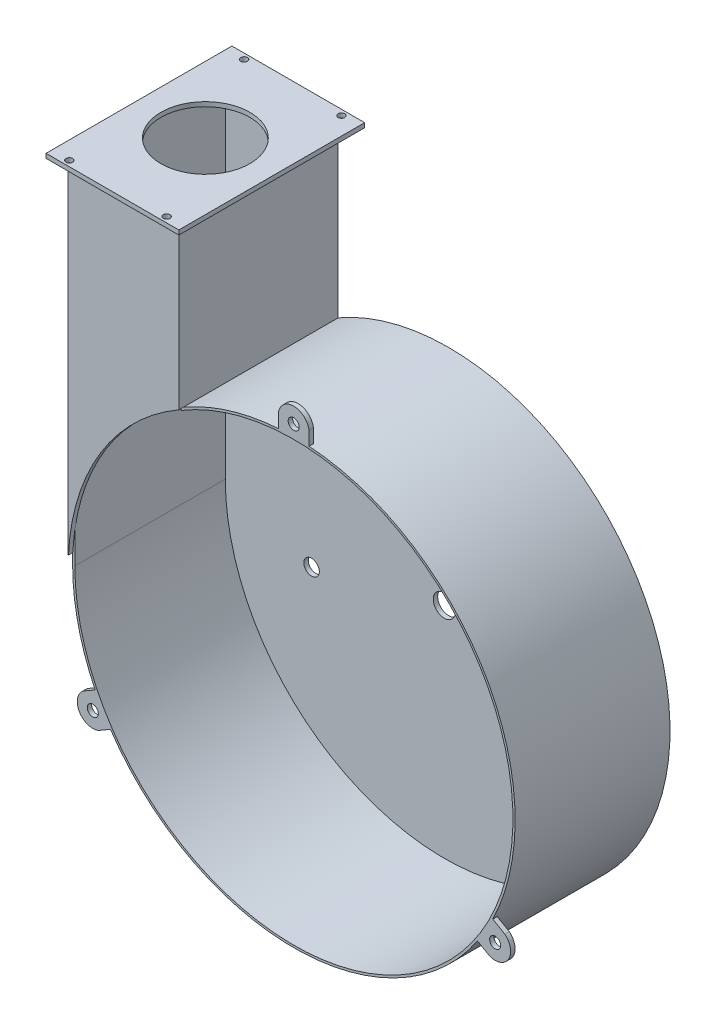
from build123d import *

# Parameters (mm, degrees)
IZIM1_R                     = 3.5
IZIM1_R_2                   = 5
Y_KSEKLIK_EKSTR_ZYON1_DEPTH = 2
Y_KSEKLIK_EKSTR_ZYON3_DEPTH = 68
Y_KSEKLIK_EKSTR_ZYON4_DEPTH = 2
Y_KSEKLIK_EKSTR_ZYON6_START = -2
IZIM6_R                     = 2.5
Y_KSEKLIK_EKSTR_ZYON6_DEPTH = 2
IZIM8_W                     = 60
IZIM8_H                     = 84
IZIM8_R                     = 20.122069198
IZIM8_R_2                   = 1.5
Y_KSEKLIK_EKSTR_ZYON7_DEPTH = 2


with BuildPart() as part:
    # Çizim1 → Yükseklik-Ekstrüzyon1 (new body)
    with BuildSketch(Plane.XY):
        with BuildLine():
            Line((-100, 0), (-100, 160))
            Line((-100, 160), (-50, 160))
            Line((-50, 160), (-50, 86.602540378))
            ThreePointArc((-50, 86.602540378), (86.602540378, -50), (-100, 0))
        make_face()
        with Locations((-60, -15)):
            Circle(IZIM1_R, mode=Mode.SUBTRACT)
        with Locations((60, -15)):
            Circle(IZIM1_R, mode=Mode.SUBTRACT)
        Circle(IZIM1_R_2, mode=Mode.SUBTRACT)
    extrude(amount=Y_KSEKLIK_EKSTR_ZYON1_DEPTH)

    # Çizim2 → Yükseklik-Ekstrüzyon3 (add)
    with BuildSketch(Plane.XY.offset(2)):
        with BuildLine():
            Line((-50, 86.602540378), (-50, 160))
            Line((-50, 160), (-51, 160))
            Line((-51, 160), (-51, 159))
            Line((-51, 159), (-51, 84.852813742))
            ThreePointArc((-51, 84.852813742), (86.168439698, -48.744230428), (-99, 0))
            Line((-99, 0), (-99, 159))
            Line((-99, 159), (-99, 160))
            Line((-99, 160), (-100, 160))
            Line((-100, 160), (-100, 0))
            ThreePointArc((-100, 0), (86.602540378, -50), (-50, 86.602540378))
        make_face()
    extrude(amount=Y_KSEKLIK_EKSTR_ZYON3_DEPTH)

    # Çizim4 → Yükseklik-Ekstrüzyon4 (add)
    with BuildSketch(Plane.XY.offset(70)):
        with BuildLine():
            Line((-100, 160), (-50, 160))
            Line((-50, 160), (-50, 86.602540378))
            ThreePointArc((-50, 86.602540378), (-85.384878706, 52.052113198), (-99.88613884, 4.77066743))
            Line((-99.88613884, 4.77066743), (-100, 4.77066743))
            Line((-100, 4.77066743), (-100, 160))
        make_face()
    extrude(amount=Y_KSEKLIK_EKSTR_ZYON4_DEPTH)

    # Çizim6 → Yükseklik-Ekstrüzyon6 (add)
    # profile 1 of 3: a face of its own
    with BuildSketch(Plane.XY.offset(70).offset(Y_KSEKLIK_EKSTR_ZYON6_START)):
        with BuildLine():
            ThreePointArc((-7, 99.754699137), (-0.077865091, 99.999969685), (6.844643384, 99.765479285))
            Line((6.844643384, 99.765479285), (6.844643384, 106.039933839))
            ThreePointArc((6.844643384, 106.039933839), (-0.077678308, 112), (-7, 106.039933839))
            Line((-7, 106.039933839), (-7, 99.754699137))
        make_face()
        with Locations((-0.077678308, 105)):
            Circle(IZIM6_R, mode=Mode.SUBTRACT)
    # profile 2 of 3: a face of its own
    with BuildSketch(Plane.XY.offset(70).offset(Y_KSEKLIK_EKSTR_ZYON6_START)):
        with BuildLine():
            Line((-88.33327652, -59.082144746), (-82.8901036, -55.939527395))
            ThreePointArc((-82.8901036, -55.939527395), (-86.563581579, -50.067417989), (-89.821761174, -43.955104592))
            Line((-89.821761174, -43.955104592), (-95.255598212, -47.092331869))
            ThreePointArc((-95.255598212, -47.092331869), (-96.95600607, -56.067271388), (-88.33327652, -59.082144746))
        make_face()
        with Locations((-90.893828243, -52.567271388)):
            Circle(IZIM6_R, mode=Mode.SUBTRACT)
    # profile 3 of 3: a face of its own
    with BuildSketch(Plane.XY.offset(70).offset(Y_KSEKLIK_EKSTR_ZYON6_START)):
        with BuildLine():
            ThreePointArc((88.410954828, -58.94760197), (97.033684378, -55.932728612), (95.33327652, -46.957789093))
            Line((95.33327652, -46.957789093), (89.8901036, -43.815171742))
            ThreePointArc((89.8901036, -43.815171742), (86.641446671, -49.932551696), (82.977117789, -55.810374693))
            Line((82.977117789, -55.810374693), (88.410954828, -58.94760197))
        make_face()
        with Locations((90.971506551, -52.432728612)):
            Circle(IZIM6_R, mode=Mode.SUBTRACT)
    extrude(amount=Y_KSEKLIK_EKSTR_ZYON6_DEPTH)

    # Çizim8 → Yükseklik-Ekstrüzyon7 (add)
    with BuildSketch(Plane(origin=(0, 160, 0), x_dir=(1, 0, 0), z_dir=(0, 1, 0))):
        with Locations((-75, -35)):
            Rectangle(IZIM8_W, IZIM8_H)
        with Locations(Location((-75, -35, 0), (0, 0, 270))):
            Circle(IZIM8_R, mode=Mode.SUBTRACT)
        with Locations(Location((-97, 4.5, 0), (0, 0, 270))):
            Circle(IZIM8_R_2, mode=Mode.SUBTRACT)
        with Locations(Location((-53, 4.5, 0), (0, 0, 270))):
            Circle(IZIM8_R_2, mode=Mode.SUBTRACT)
        with Locations(Location((-53, -74.5, 0), (0, 0, 270))):
            Circle(IZIM8_R_2, mode=Mode.SUBTRACT)
        with Locations(Location((-97, -74.5, 0), (0, 0, 270))):
            Circle(IZIM8_R_2, mode=Mode.SUBTRACT)
    extrude(amount=Y_KSEKLIK_EKSTR_ZYON7_DEPTH)


solid = part.part
